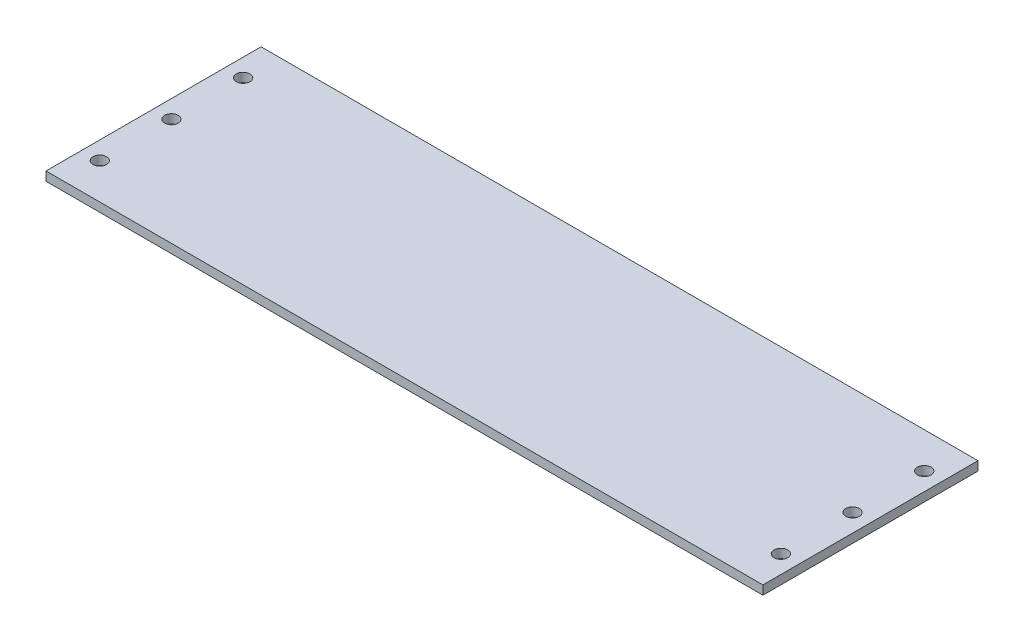
from build123d import *

# Parameters (mm, degrees)
SKETCH1_W           = 254
SKETCH1_H           = 76.2
SKETCH1_R           = 2.413
BOSS_EXTRUDE1_DEPTH = 3.175


with BuildPart() as part:
    # Sketch1 → Boss-Extrude1 (new body)
    with BuildSketch(Plane(origin=(0, 0, 0), x_dir=(1, 0, 0), z_dir=(0, 1, 0))):
        with Locations((127, 38.1)):
            Rectangle(SKETCH1_W, SKETCH1_H)
        with Locations(Location((6.35, 63.5, 0), (0, 0, 270))):
            Circle(SKETCH1_R, mode=Mode.SUBTRACT)
        with Locations(Location((6.35, 38.1, 0), (0, 0, 270))):
            Circle(SKETCH1_R, mode=Mode.SUBTRACT)
        with Locations(Location((6.35, 12.7, 0), (0, 0, 270))):
            Circle(SKETCH1_R, mode=Mode.SUBTRACT)
        with Locations(Location((247.65, 12.7, 0), (0, 0, 90))):
            Circle(SKETCH1_R, mode=Mode.SUBTRACT)
        with Locations(Location((247.65, 38.1, 0), (0, 0, 90))):
            Circle(SKETCH1_R, mode=Mode.SUBTRACT)
        with Locations(Location((247.65, 63.5, 0), (0, 0, 90))):
            Circle(SKETCH1_R, mode=Mode.SUBTRACT)
    extrude(amount=BOSS_EXTRUDE1_DEPTH)


solid = part.part
